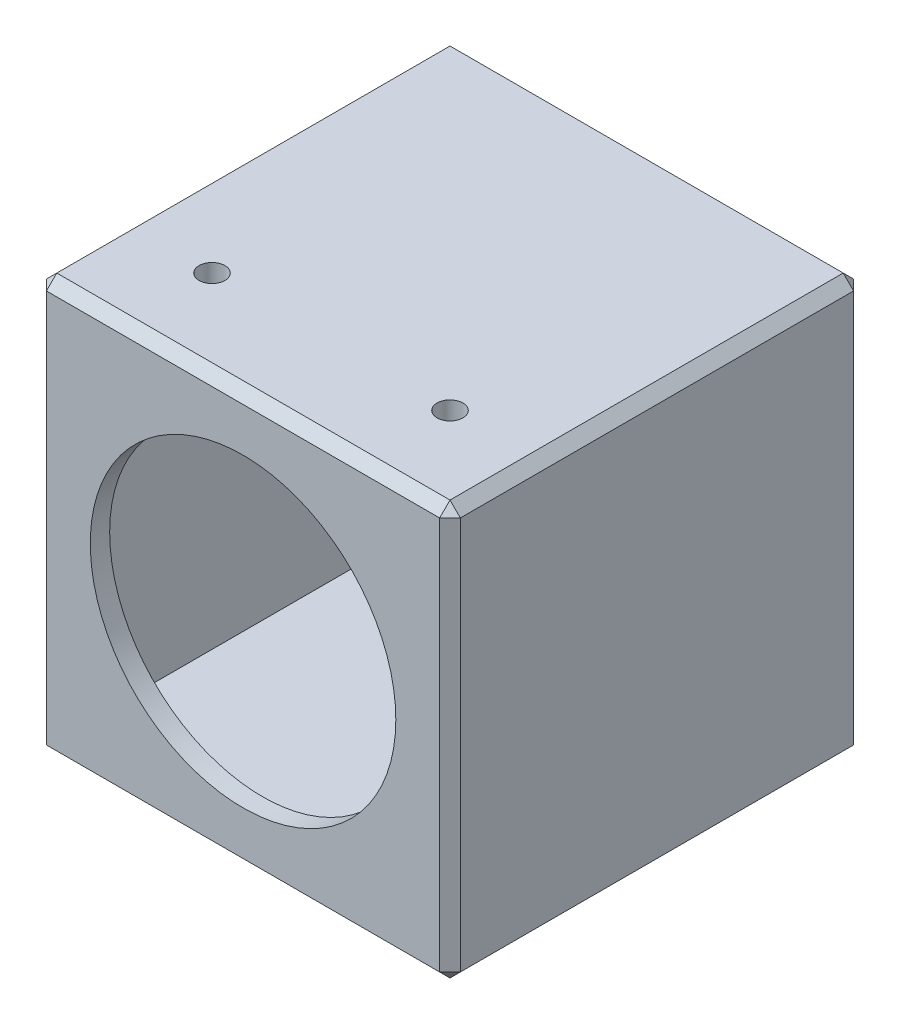
from build123d import *

# Parameters (mm, degrees)
SKETCH1_W           = 101.6
SKETCH1_H           = 101.6
BOSS_EXTRUDE1_DEPTH = 101.6
CHAMFER1_SIZE       = 2.54
SHELL1_T            = 4.7625
CUT_EXTRUDE1_REACH  = 154.4
SKETCH2_R           = 37.5
CUT_EXTRUDE2_REACH  = 126.434
SKETCH3_R           = 3.175


with BuildPart() as part:
    # Sketch1 → Boss-Extrude1 (new body)
    with BuildSketch(Plane(origin=(0, 0, 0), x_dir=(1, 0, 0), z_dir=(0, 1, 0))):
        Rectangle(SKETCH1_W, SKETCH1_H)
    extrude(amount=BOSS_EXTRUDE1_DEPTH)

    # Chamfer1
    chamfer1_edges = [part.edges().sort_by_distance(p)[0] for p in [
        (50.8, 101.6, 0),
        (0, 101.6, -50.8),
        (-50.8, 101.6, 0),
        (0, 0, -50.8),
        (50.8, 0, 0),
        (0, 0, 50.8),
        (-50.8, 0, 0),
        (0, 101.6, 50.8),
        (-50.8, 50.8, -50.8),
        (50.8, 50.8, -50.8),
        (50.8, 50.8, 50.8),
        (-50.8, 50.8, 50.8),
    ]]
    chamfer(chamfer1_edges, length=CHAMFER1_SIZE)

    # Shell1 (no face opened: a closed hollow body)
    add(offset(amount=-SHELL1_T, mode=Mode.PRIVATE), mode=Mode.SUBTRACT)

    # Sketch2 → Cut-Extrude1 (cut, up to next)
    with BuildSketch(Plane.XY.offset(50.8), mode=Mode.PRIVATE) as cut_extrude1_sk1:
        with Locations((0, 50.8)):
            Circle(SKETCH2_R)
    cut_extrude1_tool1 = extrude(cut_extrude1_sk1.sketch, amount=-CUT_EXTRUDE1_REACH, mode=Mode.PRIVATE) & part.part
    add(cut_extrude1_tool1.solids().sort_by_distance((0, 50.8, 50.8))[0], mode=Mode.SUBTRACT)

    # Sketch3 → Cut-Extrude2 (cut, up to next)
    with BuildSketch(Plane(origin=(0, 101.6, 0), x_dir=(1, 0, 0), z_dir=(0, 1, 0)), mode=Mode.PRIVATE) as cut_extrude2_sk1:
        with Locations(Location((-29.21, -29.21, 0), (0, 0, 270))):
            Circle(SKETCH3_R)
    cut_extrude2_tool1 = extrude(cut_extrude2_sk1.sketch, amount=-CUT_EXTRUDE2_REACH, mode=Mode.PRIVATE) & part.part
    # Sketch3 → Cut-Extrude2 (cut, up to next)
    with BuildSketch(Plane(origin=(0, 101.6, 0), x_dir=(1, 0, 0), z_dir=(0, 1, 0)), mode=Mode.PRIVATE) as cut_extrude2_sk2:
        with Locations(Location((29.21, -29.21, 0), (0, 0, 270))):
            Circle(SKETCH3_R)
    cut_extrude2_tool2 = extrude(cut_extrude2_sk2.sketch, amount=-CUT_EXTRUDE2_REACH, mode=Mode.PRIVATE) & part.part
    add(cut_extrude2_tool1.solids().sort_by_distance((-29.21, 101.6, 29.21))[0], mode=Mode.SUBTRACT)
    add(cut_extrude2_tool2.solids().sort_by_distance((29.21, 101.6, 29.21))[0], mode=Mode.SUBTRACT)


solid = part.part
